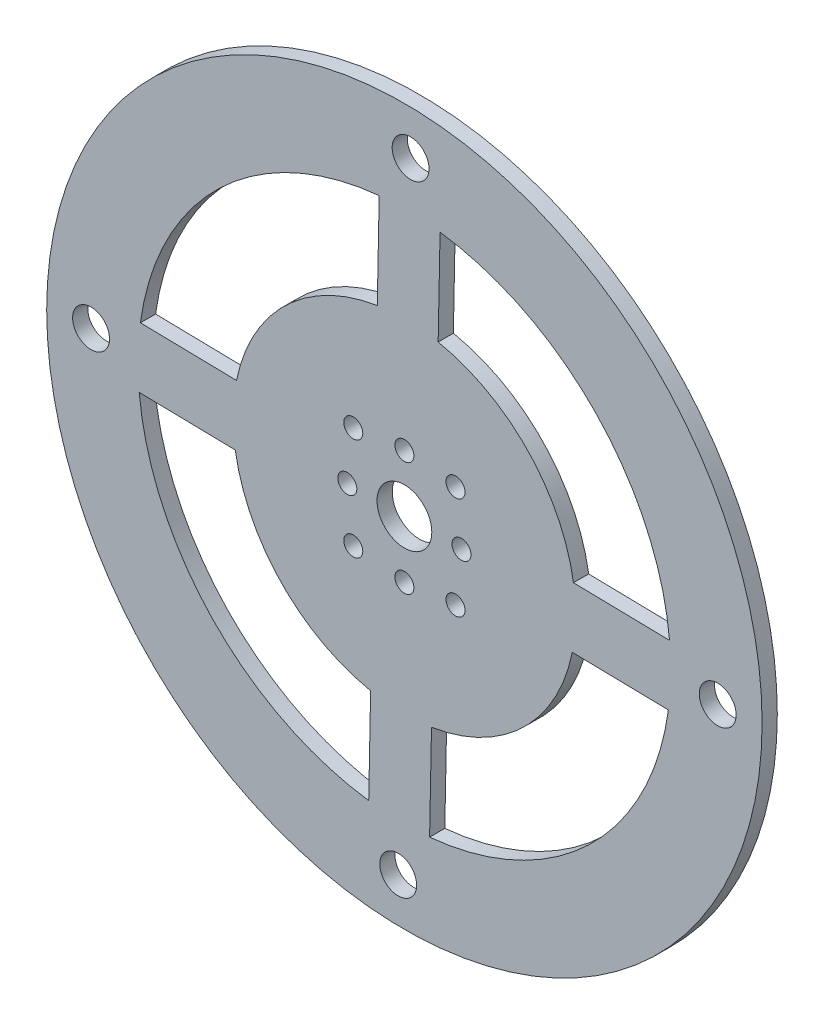
from build123d import *

# Parameters (mm, degrees)
SKETCH_2_R      = 47
SKETCH_2_R_2    = 2.425
SKETCH_2_R_3    = 35
SKETCH_2_R_4    = 22.5
SKETCH_2_R_5    = 1.25
SKETCH_2_R_6    = 3.6
EXTRUDE_1_DEPTH = 2


with BuildPart() as part:
    # 草图2 → 凸台-拉伸1 (new body)
    # profile 1 of 6: a face of its own
    with BuildSketch(Plane.XY):
        Circle(SKETCH_2_R)
        with Locations((-0.813609012, -41.166960847)):
            Circle(SKETCH_2_R_2, mode=Mode.SUBTRACT)
        Circle(SKETCH_2_R_3, mode=Mode.SUBTRACT)
        with Locations((0.813609012, 41.166960847)):
            Circle(SKETCH_2_R_2, mode=Mode.SUBTRACT)
        with Locations((41.166960847, -0.813609012)):
            Circle(SKETCH_2_R_2, mode=Mode.SUBTRACT)
        with Locations((-41.166960847, 0.813609012)):
            Circle(SKETCH_2_R_2, mode=Mode.SUBTRACT)
    # profile 2 of 6: a face of its own
    with BuildSketch(Plane.XY):
        with BuildLine():
            Line((-34.842927678, -3.312158032), (-22.21630595, -3.561706044))
            ThreePointArc((-22.21630595, -3.561706044), (-22.49560702, 0.444595088), (-22.058227696, 4.436732007))
            Line((-22.058227696, 4.436732007), (-34.684849424, 4.686280019))
            ThreePointArc((-34.684849424, 4.686280019), (-34.993166476, 0.69159236), (-34.842927678, -3.312158032))
        make_face()
    # profile 3 of 6: a face of its own
    with BuildSketch(Plane.XY):
        with BuildLine():
            Line((3.312158032, -34.842927678), (3.561706044, -22.21630595))
            ThreePointArc((3.561706044, -22.21630595), (-0.444595088, -22.49560702), (-4.436732007, -22.058227696))
            Line((-4.436732007, -22.058227696), (-4.686280019, -34.684849424))
            ThreePointArc((-4.686280019, -34.684849424), (-0.69159236, -34.993166476), (3.312158032, -34.842927678))
        make_face()
    # profile 4 of 6: a face of its own
    with BuildSketch(Plane.XY):
        with BuildLine():
            ThreePointArc((22.5, 0), (22.389284526, -2.229335869), (22.058227696, -4.436732007))
            Line((22.058227696, -4.436732007), (34.684849424, -4.686280019))
            ThreePointArc((34.684849424, -4.686280019), (34.921123477, -2.348432472), (35, 0))
            ThreePointArc((35, 0), (34.960709866, 1.657940179), (34.842927678, 3.312158032))
            Line((34.842927678, 3.312158032), (22.21630595, 3.561706044))
            ThreePointArc((22.21630595, 3.561706044), (22.428964353, 1.786493231), (22.5, 0))
        make_face()
    # profile 5 of 6: a face of its own
    with BuildSketch(Plane.XY):
        with BuildLine():
            Line((-3.312158032, 34.842927678), (-3.561706044, 22.21630595))
            ThreePointArc((-3.561706044, 22.21630595), (0.444595088, 22.49560702), (4.436732007, 22.058227696))
            Line((4.436732007, 22.058227696), (4.686280019, 34.684849424))
            ThreePointArc((4.686280019, 34.684849424), (0.69159236, 34.993166476), (-3.312158032, 34.842927678))
        make_face()
    # profile 6 of 6: a face of its own
    with BuildSketch(Plane.XY):
        Circle(SKETCH_2_R_4)
        with Locations((7.5, 0)):
            Circle(SKETCH_2_R_5, mode=Mode.SUBTRACT)
        with Locations((0, 7.5)):
            Circle(SKETCH_2_R_5, mode=Mode.SUBTRACT)
        with Locations((0, -7.5)):
            Circle(SKETCH_2_R_5, mode=Mode.SUBTRACT)
        with Locations((-6.717514421, 6.717514421)):
            Circle(SKETCH_2_R_5, mode=Mode.SUBTRACT)
        with Locations((-6.717514421, -6.717514421)):
            Circle(SKETCH_2_R_5, mode=Mode.SUBTRACT)
        with Locations((6.717514421, -6.717514421)):
            Circle(SKETCH_2_R_5, mode=Mode.SUBTRACT)
        with Locations((-7.5, 0)):
            Circle(SKETCH_2_R_5, mode=Mode.SUBTRACT)
        with Locations((6.717514421, 6.717514421)):
            Circle(SKETCH_2_R_5, mode=Mode.SUBTRACT)
        Circle(SKETCH_2_R_6, mode=Mode.SUBTRACT)
    extrude(amount=EXTRUDE_1_DEPTH)


solid = part.part
